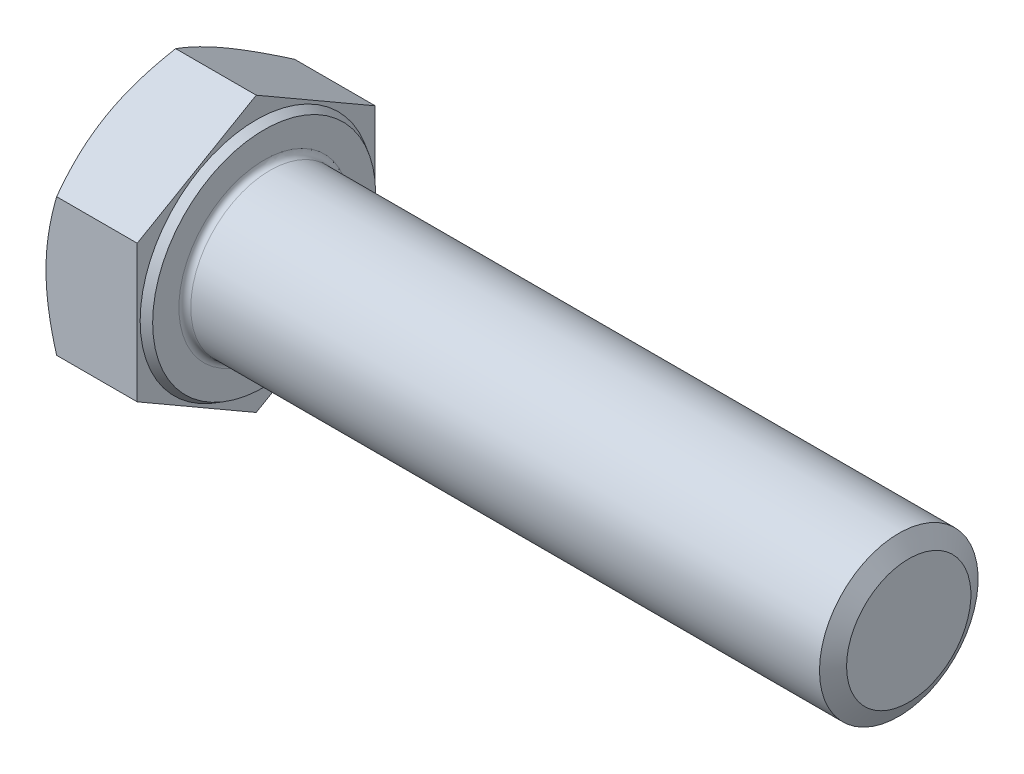
from build123d import *

# Parameters (mm, degrees)
EXTRUDE_382_DEPTH = 10
FILLET_1302_R     = 0.6


with BuildPart() as part:
    # 草图1 → Extrude 382 (new body)
    with BuildSketch(Plane(origin=(0, 0, 0), x_dir=(0, 0, -1), z_dir=(1, 0, 0))):
        Polygon((12, 6.92820323), (12, -6.92820323), (0, -13.856406461), (-12, -6.92820323), (-12, 6.92820323), (0, 13.856406461), align=None)
    extrude(amount=EXTRUDE_382_DEPTH)

    # 草图2 → 凸台-旋转1 (revolve)
    with BuildSketch(Plane.XY, mode=Mode.PRIVATE) as revolve_1_sk:
        Polygon((0, 0), (75, 0), (75, 6.268), (75, 8), (37, 8), (0, 8), align=None)
    revolve(revolve_1_sk.sketch.rotate(Axis((0, 0, 0), (1, 0, 0)), 90), axis=Axis((0, 0, 0), (1, 0, 0)))

    # 草图3 → 切除-旋转1 (revolve, cut)
    with BuildSketch(Plane.XY):
        Polygon((0, 12), (3.958548116, 18.856406461), (3.958548116, 23.856406461), (-10, 23.856406461), (-10, 12), align=None)
    revolve(axis=Axis((0, 0, 0), (1, 0, 0)), mode=Mode.SUBTRACT)

    # 草图4 → 切除-旋转3 (revolve, cut)
    with BuildSketch(Plane.XY, mode=Mode.PRIVATE) as cut_revolve_3_sk:
        Polygon((10, 11.245), (9.2, 11.706880215), (9.2, 13.856406461), (10, 13.856406461), align=None)
    revolve(cut_revolve_3_sk.sketch.rotate(Axis((0, 0, 0), (1, 0, 0)), 90), axis=Axis((0, 0, 0), (1, 0, 0)), mode=Mode.SUBTRACT)

    # Fillet 1302
    fillet_1302_edges = [part.edges().sort_by_distance(p)[0] for p in [
        (10, 0, -8),
    ]]
    fillet(fillet_1302_edges, radius=FILLET_1302_R)

    # 草图6 → 切除-旋转4 (revolve, cut)
    with BuildSketch(Plane.XY, mode=Mode.PRIVATE) as cut_revolve_4_sk:
        Polygon((74, 8), (76, 8), (75, 6.267949192), align=None)
    revolve(cut_revolve_4_sk.sketch.rotate(Axis((0, 0, 0), (1, 0, 0)), 90), axis=Axis((0, 0, 0), (1, 0, 0)), mode=Mode.SUBTRACT)


solid = part.part
